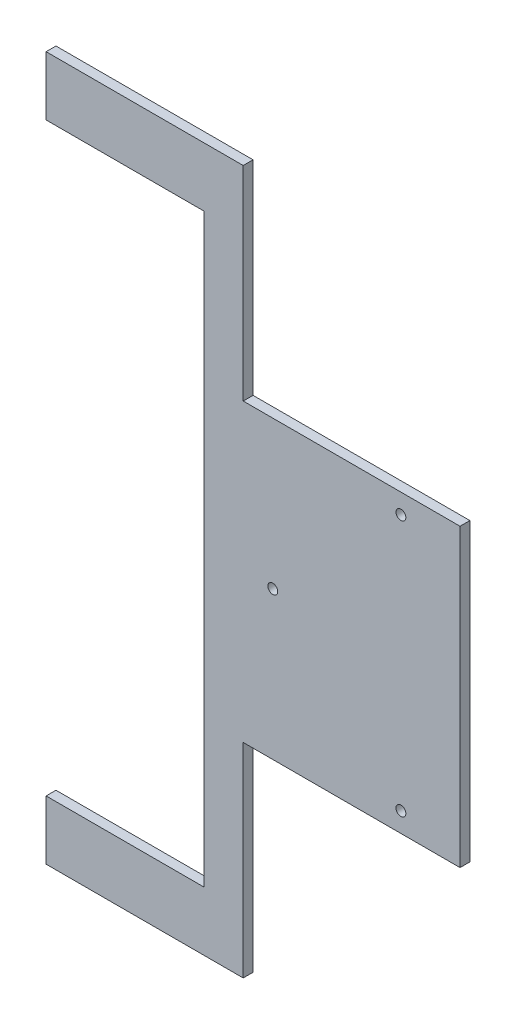
from build123d import *

# Parameters (mm, degrees)
SKETCH1_R           = 2.5
BOSS_EXTRUDE1_DEPTH = 5


with BuildPart() as part:
    # Sketch1 → Boss-Extrude1 (new body)
    with BuildSketch(Plane.XY):
        Polygon((-49.999307958, 92.545526446), (60.000692042, 92.545526446), (60.000692042, -57.454473554), (-49.999307958, -57.454473554), (-49.999307958, -130.954473554), (-49.999307958, -160.954473554), (-149.999307958, -160.954473554), (-149.999307958, -130.954473554), (-69.999307958, -130.954473554), (-69.999307958, 166.045526446), (-149.999307958, 166.045526446), (-149.999307958, 196.045526446), (-49.999307958, 196.045526446), (-49.999307958, 166.045526446), align=None)
        with Locations((-34.999307958, 17.545526446)):
            Circle(SKETCH1_R, mode=Mode.SUBTRACT)
        with Locations((30.000692042, -47.454473554)):
            Circle(SKETCH1_R, mode=Mode.SUBTRACT)
        with Locations((30.000692042, 82.545526446)):
            Circle(SKETCH1_R, mode=Mode.SUBTRACT)
    extrude(amount=BOSS_EXTRUDE1_DEPTH)


solid = part.part
